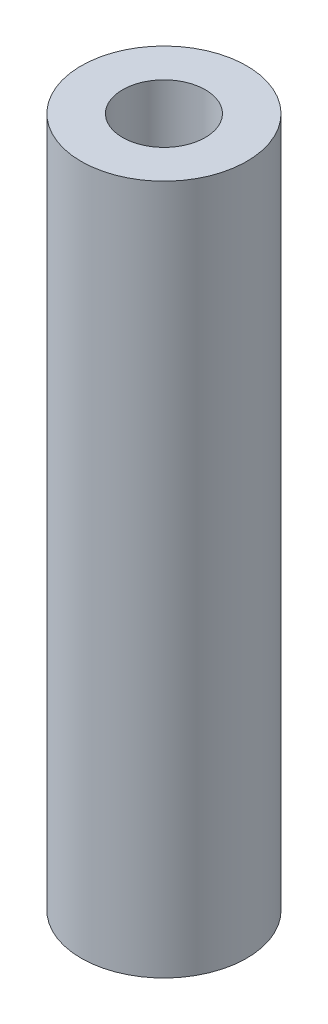
from build123d import *

# Parameters (mm, degrees)
SKETCH1_R           = 3
SKETCH1_R_2         = 1.5
BOSS_EXTRUDE1_DEPTH = 25


with BuildPart() as part:
    # Sketch1 → Boss-Extrude1 (new body)
    with BuildSketch(Plane(origin=(0, 0, 0), x_dir=(1, 0, 0), z_dir=(0, 1, 0))):
        with Locations(Location((0, 0, 0), (0, 0, 270))):
            Circle(SKETCH1_R)
        with Locations(Location((0, 0, 0), (0, 0, 270))):
            Circle(SKETCH1_R_2, mode=Mode.SUBTRACT)
    extrude(amount=BOSS_EXTRUDE1_DEPTH)


solid = part.part
